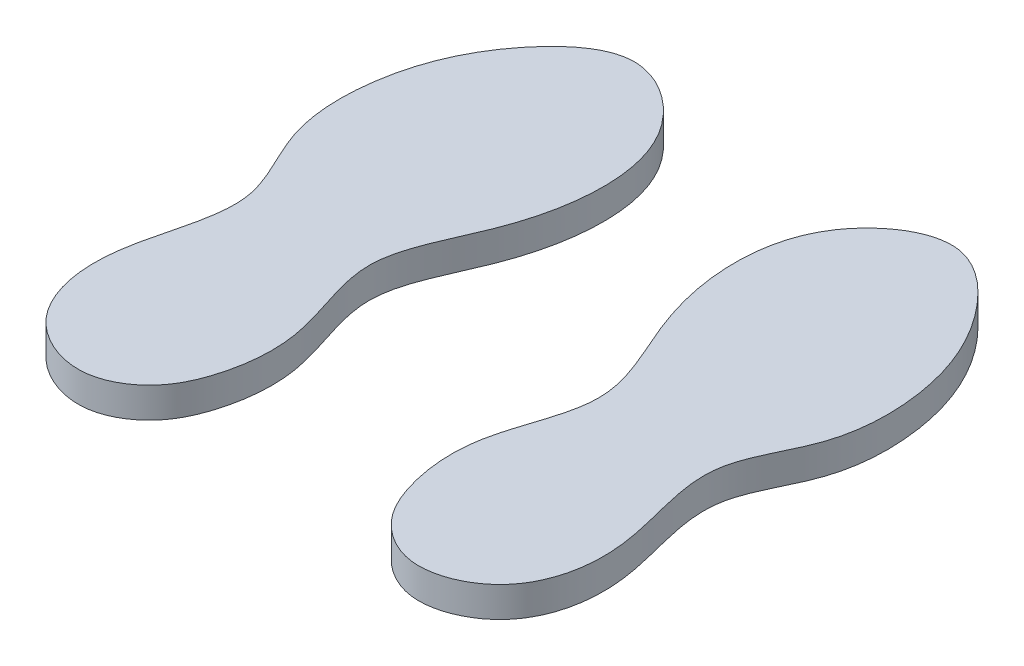
from build123d import *

# Parameters (mm, degrees)
BOSS_EXTRUDE4_DEPTH   = 20
BOSS_EXTRUDE4_2_DEPTH = 20


with BuildPart() as part:
    # Sketch4 → Boss-Extrude4 (new body)
    with BuildSketch(Plane(origin=(0, 0, 0), x_dir=(1, 0, 0), z_dir=(0, 1, 0))):
        with BuildLine():
            add(Edge.make_bspline(
                [(106.544097631, 392.449119023), (122.658150077, 391.466501961), (161.174594343, 358.166552057), (182.82392291, 300.142147188), (179.371588261, 236.959772497), (143.32218801, 183.773719871), (170.286769279, 125.556087092), (167.436859462, 76.340355288), (147.656228747, 42.946319599), (109.875408578, 26.315110761), (74.554843466, 48.635410805), (59.741237181, 83.871043916), (56.202256601, 132.581501852), (86.901930064, 189.336253955), (54.252894308, 247.024201151), (39.399948672, 305.112339134), (48.670414959, 365.596312938), (88.98808942, 393.51966495), (106.544097631, 392.449119023)],
                knots=[0, 0, 0, 0, 0.06070552, 0.156337144, 0.218930963, 0.279880895, 0.369614909, 0.425901175, 0.449068035, 0.506702922, 0.548647895, 0.583423384, 0.640397757, 0.718760148, 0.793011406, 0.859143312, 0.933862285, 1, 1, 1, 1], degree=3))
        make_face()
    extrude(amount=BOSS_EXTRUDE4_DEPTH)


with BuildPart() as body_2:
    # Sketch4 → Boss-Extrude4 2 (new body)
    with BuildSketch(Plane(origin=(0, 0, 0), x_dir=(1, 0, 0), z_dir=(0, 1, 0))):
        with BuildLine():
            add(Edge.make_bspline(
                [(-106.544097631, 392.449119023), (-122.658150077, 391.466501961), (-161.174594343, 358.166552057), (-182.82392291, 300.142147188), (-179.371588261, 236.959772497), (-143.32218801, 183.773719871), (-170.286769279, 125.556087092), (-167.436859462, 76.340355288), (-147.656228747, 42.946319599), (-109.875408578, 26.315110761), (-74.554843466, 48.635410805), (-59.741237181, 83.871043916), (-56.202256601, 132.581501852), (-86.901930064, 189.336253955), (-54.252894308, 247.024201151), (-39.399948672, 305.112339134), (-48.670414959, 365.596312938), (-88.98808942, 393.51966495), (-106.544097631, 392.449119023)],
                knots=[0, 0, 0, 0, 0.06070552, 0.156337144, 0.218930963, 0.279880895, 0.369614909, 0.425901175, 0.449068035, 0.506702922, 0.548647895, 0.583423384, 0.640397757, 0.718760148, 0.793011406, 0.859143312, 0.933862285, 1, 1, 1, 1], degree=3))
        make_face()
    extrude(amount=BOSS_EXTRUDE4_2_DEPTH)


solid = Compound([part.part, body_2.part])
